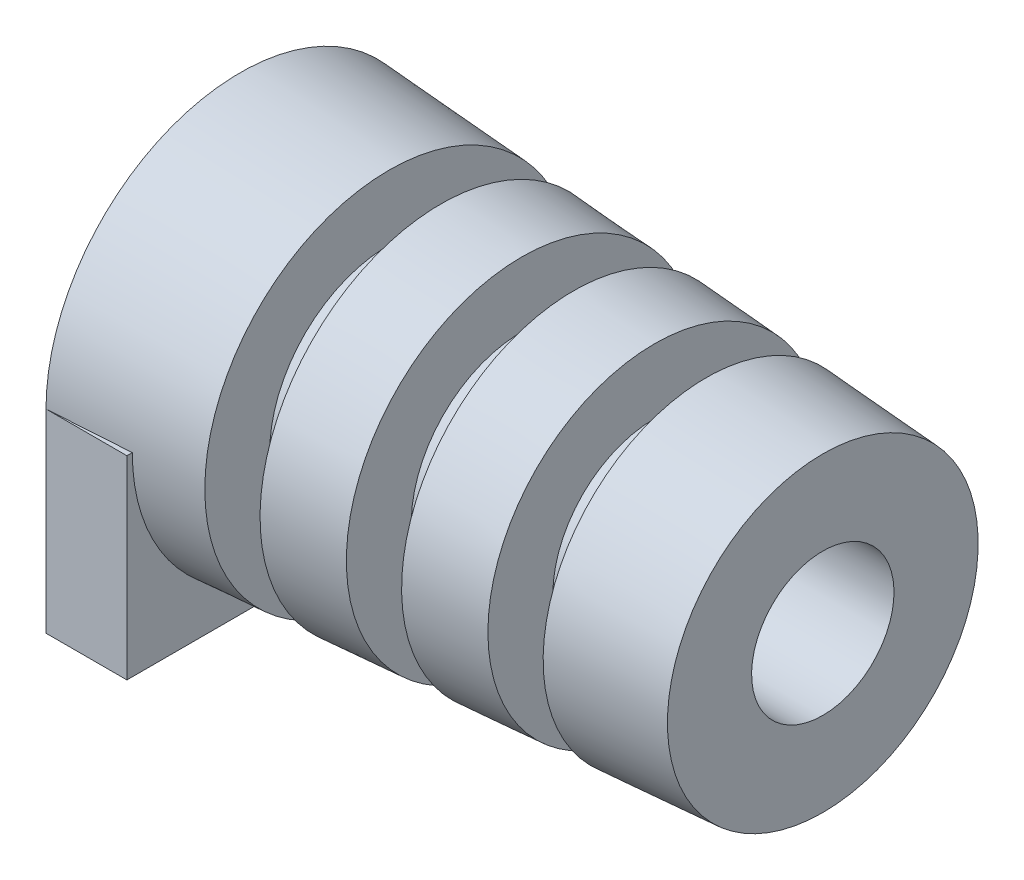
from build123d import *

# Parameters (mm, degrees)
EXTRUDE2_DEPTH = 3.175


with BuildPart() as part:
    # Sketch2 → Revolve-Thin2 (revolve)
    with BuildSketch(Plane(origin=(54.9, 0, 50.401640227), x_dir=(-1, 0, 0), z_dir=(0, 0, -1))):
        Polygon((46.764200866, -1.710829687), (46.764200866, 0.8348085), (48.796200866, 0.699341833), (48.796200866, -1.846296354), (54.638200866, -2.23576302), (54.638200866, 2.59023698), (31.778200866, 2.59023698), (31.778200866, -0.71176302), (36.350200866, -1.01656302), (36.350200866, 1.529075166), (38.382200866, 1.3936085), (38.382200866, -1.152029687), (41.557200866, -1.363696354), (41.557200866, 1.181941833), (43.589200866, 1.046475166), (43.589200866, -1.49916302), align=None)
        Polygon((46.763997666, -1.710612489), (46.763997666, 0.835025698), (48.796404066, 0.699531938), (48.796404066, -1.846106249), (54.637997666, -2.235545823), (54.637997666, 2.59003378), (31.778404066, 2.59003378), (31.778404066, -0.711572916), (36.349997666, -1.016345823), (36.349997666, 1.529292364), (38.382404066, 1.393798604), (38.382404066, -1.151839583), (41.556997666, -1.363479156), (41.556997666, 1.182159031), (43.589404066, 1.046665271), (43.589404066, -1.498972916), align=None, mode=Mode.SUBTRACT)
    revolve(axis=Axis((0.261799134, 5.38423698, 50.401640227), (1, 0, 0)))

    # Sketch4 → Extrude2 (add)
    with BuildSketch(Plane.ZY.offset(-0.261595934)):
        with BuildLine():
            Line((42.781423057, 5.38423698), (42.781423057, -2.23598019))
            Line((42.781423057, -2.23598019), (58.021857397, -2.23598019))
            Line((58.021857397, -2.23598019), (58.021857397, 5.38423698))
            Line((58.021857397, 5.38423698), (57.513640227, 5.38423698))
            ThreePointArc((57.513640227, 5.38423698), (50.401640227, -1.72776302), (43.289640227, 5.38423698))
            Line((43.289640227, 5.38423698), (42.781423057, 5.38423698))
        make_face()
    extrude(amount=-EXTRUDE2_DEPTH)


solid = part.part
